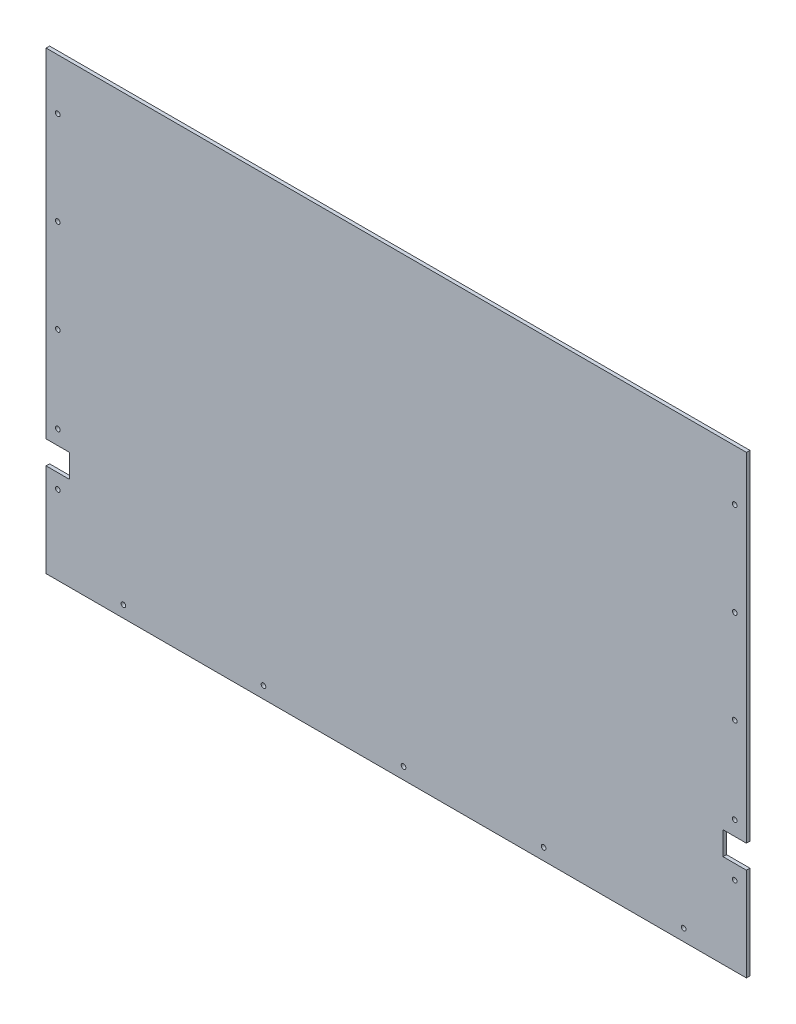
from build123d import *

# Parameters (mm, degrees)
SKETCH1_W             = 600
SKETCH1_H             = 390
BOSS_EXTRUDE1_DEPTH   = 3
SKETCH2_W             = 20
SKETCH2_H             = 20
CUT_EXTRUDE1_DEPTH    = 3
F_4_0MM_DOWEL_HOLE1_D = 4


with BuildPart() as part:
    # Sketch1 → Boss-Extrude1 (new body)
    with BuildSketch(Plane.XY):
        with Locations((300, 195)):
            Rectangle(SKETCH1_W, SKETCH1_H)
    extrude(amount=BOSS_EXTRUDE1_DEPTH)

    # Sketch2 → Cut-Extrude1 (cut)
    with BuildSketch(Plane.XY.offset(3)):
        with Locations((590, 90)):
            Rectangle(SKETCH2_W, SKETCH2_H)
        with Locations((10, 90)):
            Rectangle(SKETCH2_W, SKETCH2_H)
    extrude(amount=-CUT_EXTRUDE1_DEPTH, mode=Mode.SUBTRACT)

    # Ø4.0mm Dowel Hole1 (through all)
    with Locations(Plane(origin=(0, 0, 0), x_dir=(-1, 0, 0), z_dir=(0, 0, -1))):
        with Locations((-590, 346.25), (-10, 346.25), (-10, 266.25), (-10, 186.25), (-590, 266.25), (-590, 186.25), (-590, 112.449594156), (-590, 67.550405844), (-10, 112.449594156), (-10, 67.550405844), (-66.25, 10.069105371), (-186.25, 10.069105371), (-306.25, 10.069105371), (-426.25, 10.069105371), (-546.25, 10.069105371)):
            Hole(F_4_0MM_DOWEL_HOLE1_D / 2)


solid = part.part
